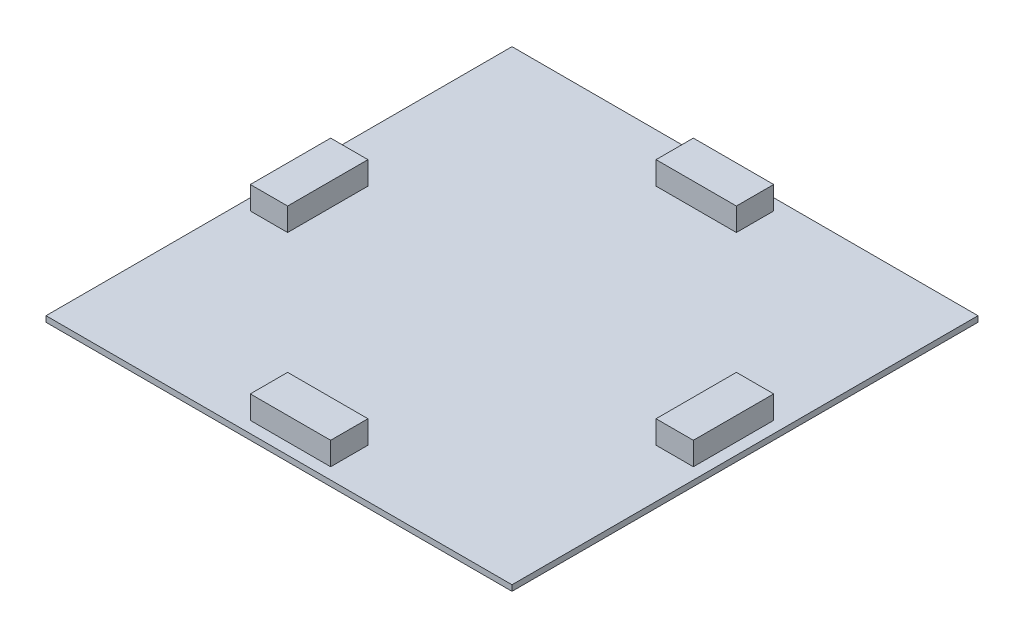
from build123d import *

# Parameters (mm, degrees)
SKETCH1_W           = 81.2
SKETCH1_H           = 81.2
BOSS_EXTRUDE1_DEPTH = 1
SKETCH1_4_W         = 14
SKETCH1_4_H         = 6.5
BOSS_EXTRUDE3_DEPTH = 4
CUT_EXTRUDE1_START  = 1
SKETCH1_5_W         = 10
SKETCH1_5_H         = 3
CUT_EXTRUDE1_DEPTH  = 2
CIRPATTERN2_COUNT   = 4


with BuildPart() as part:
    # Sketch1 → Boss-Extrude1 (new body)
    with BuildSketch(Plane(origin=(0, 0, 0), x_dir=(1, 0, 0), z_dir=(0, 1, 0))):
        with Locations((4.005258085, 4.818334453)):
            Rectangle(SKETCH1_W, SKETCH1_H)
    extrude(amount=-BOSS_EXTRUDE1_DEPTH)

    # Sketch1<4> → Boss-Extrude3 (add)
    with BuildSketch(Plane(origin=(0, 0, 0), x_dir=(1, 0, 0), z_dir=(0, 1, 0))):
        with Locations((4.005258085, 40.168334453)):
            Rectangle(SKETCH1_4_W, SKETCH1_4_H)
    boss_extrude3 = extrude(amount=BOSS_EXTRUDE3_DEPTH)

    # Sketch1<5> → Cut-Extrude1 (cut)
    with BuildSketch(Plane(origin=(0, 0, 0), x_dir=(1, 0, 0), z_dir=(0, 1, 0)).offset(CUT_EXTRUDE1_START)):
        with Locations((4.005258085, 39.918334453)):
            Rectangle(SKETCH1_5_W, SKETCH1_5_H)
    cut_extrude1 = extrude(amount=CUT_EXTRUDE1_DEPTH, mode=Mode.SUBTRACT)

    # CirPattern2: Boss-Extrude3, Cut-Extrude1 ×4 about axis
    cirpattern2_axis = Axis((4.005258085, 0, -4.818334453), (0, 1, 0))
    add([boss_extrude3.rotate(cirpattern2_axis, i * 360 / CIRPATTERN2_COUNT) for i in range(1, CIRPATTERN2_COUNT)])
    add([cut_extrude1.rotate(cirpattern2_axis, i * 360 / CIRPATTERN2_COUNT) for i in range(1, CIRPATTERN2_COUNT)], mode=Mode.SUBTRACT)


solid = part.part
